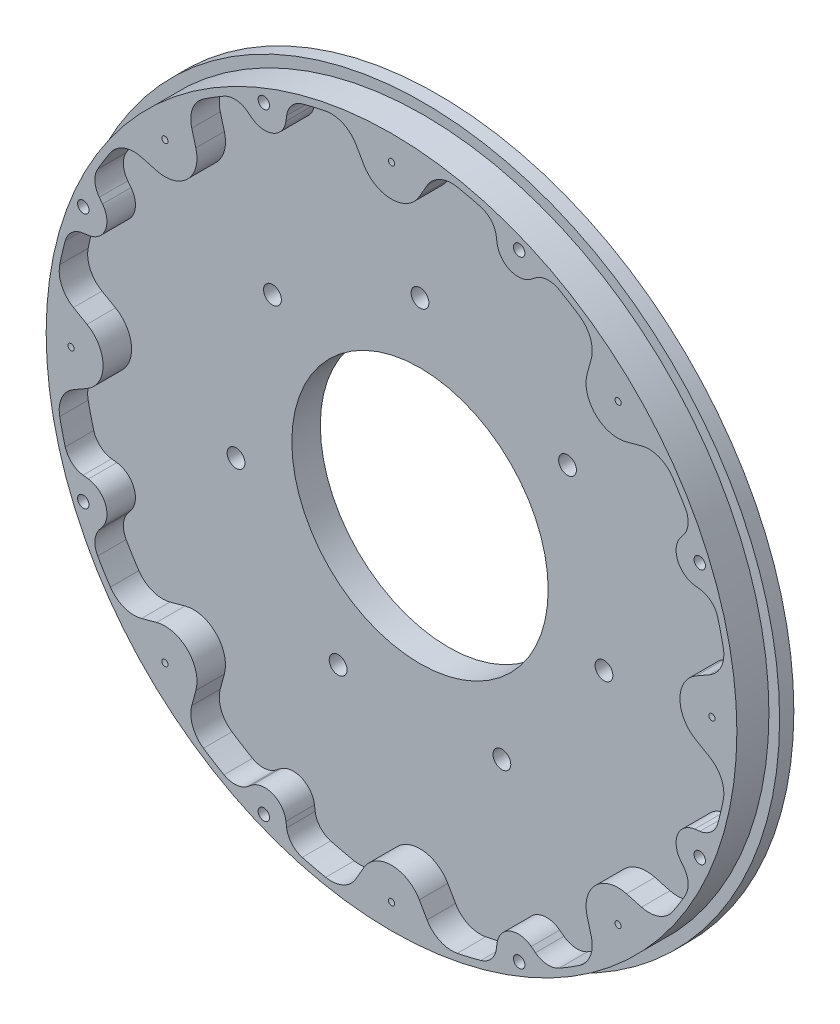
from build123d import *
from build123d.topology import SkipClean

# Parameters (mm, degrees)
SKETCH2_R             = 50
BOSS_EXTRUDE1_DEPTH   = 8
SKETCH3_R             = 18
CUT_EXTRUDE1_DEPTH    = 72.161787499
SKETCH5_R             = 50
SKETCH5_R_2           = 30
CUT_EXTRUDE2_DEPTH    = 1.5
CUT_EXTRUDE3_START    = 1.5
CUT_EXTRUDE3_DEPTH    = 1.5
CUT_EXTRUDE10_START   = 4
SKETCH18_R            = 31
SKETCH18_R_2          = 18
CUT_EXTRUDE10_DEPTH   = 4
CUT_EXTRUDE9_START    = 4
SKETCH7_R             = 31
CUT_EXTRUDE9_DEPTH    = 4
CUT_EXTRUDE12_START   = 3.5
SKETCH1_R             = 50
SKETCH1_R_2           = 48.5
CUT_EXTRUDE12_DEPTH   = 4.5
M3_TAPPED_HOLE1_D     = 2.5
M2_TAPPED_HOLE1_D     = 1.6
M2_TAPPED_HOLE1_DEPTH = 5.5
M2_TAPPED_HOLE1_TIP   = 0.480688495
M5_TAPPED_HOLE1_D     = 4.2
M5_TAPPED_HOLE1_DEPTH = 5.5
M5_TAPPED_HOLE1_TIP   = 1.2618073


with BuildPart() as part:
    # Sketch2 → Boss-Extrude1 (new body)
    with BuildSketch(Plane.XY):
        Circle(SKETCH2_R)
    extrude(amount=BOSS_EXTRUDE1_DEPTH)

    # Sketch3 → Cut-Extrude1 (cut, through all)
    with BuildSketch(Plane.XY):
        Circle(SKETCH3_R)
    extrude(amount=CUT_EXTRUDE1_DEPTH, mode=Mode.SUBTRACT)

    # Sketch5 → Cut-Extrude2 (cut)
    with BuildSketch(Plane.XY):
        Circle(SKETCH5_R)
        Circle(SKETCH5_R_2, mode=Mode.SUBTRACT)
    extrude(amount=CUT_EXTRUDE2_DEPTH, mode=Mode.SUBTRACT)

    # Sketch4 → Cut-Extrude3 (cut)
    with SkipClean():  # the faces are left unmerged after this step: merging them gives an invalid solid
        with BuildSketch(Plane.XY.offset(CUT_EXTRUDE3_START)):
            with BuildLine():
                Line((4, 41.412558482), (4, 32.249030993))
                ThreePointArc((4, 32.249030993), (4.664503168, 30.36609325), (6.363636364, 29.317300903))
                ThreePointArc((6.363636364, 29.317300903), (11.480502971, 27.716385975), (16.230691849, 25.2302327))
                ThreePointArc((16.230691849, 25.2302327), (18.173768634, 24.770372276), (19.975081377, 25.631935627))
                Line((19.975081377, 25.631935627), (26.454673804, 32.111528053))
                ThreePointArc((26.454673804, 32.111528053), (27.322845029, 34.483727178), (26.071450136, 36.678051854))
                ThreePointArc((26.071450136, 36.678051854), (17.220754456, 41.574578963), (7.5, 44.370598373))
                ThreePointArc((7.5, 44.370598373), (5.063508327, 43.703846329), (4, 41.412558482))
            make_face()
            with BuildLine():
                Line((32.111528053, 26.454673804), (25.631935627, 19.975081377))
                ThreePointArc((25.631935627, 19.975081377), (24.770372276, 18.173768634), (25.2302327, 16.230691849))
                ThreePointArc((25.2302327, 16.230691849), (27.716385975, 11.480502971), (29.317300903, 6.363636364))
                ThreePointArc((29.317300903, 6.363636364), (30.36609325, 4.664503168), (32.249030993, 4))
                Line((32.249030993, 4), (41.412558482, 4))
                ThreePointArc((41.412558482, 4), (43.703846329, 5.063508327), (44.370598373, 7.5))
                ThreePointArc((44.370598373, 7.5), (41.574578963, 17.220754456), (36.678051854, 26.071450136))
                ThreePointArc((36.678051854, 26.071450136), (34.483727178, 27.322845029), (32.111528053, 26.454673804))
            make_face()
            with BuildLine():
                Line((41.412558482, -4), (32.249030993, -4))
                ThreePointArc((32.249030993, -4), (30.36609325, -4.664503168), (29.317300903, -6.363636364))
                ThreePointArc((29.317300903, -6.363636364), (27.716385975, -11.480502971), (25.2302327, -16.230691849))
                ThreePointArc((25.2302327, -16.230691849), (24.770372276, -18.173768634), (25.631935627, -19.975081377))
                Line((25.631935627, -19.975081377), (32.111528053, -26.454673804))
                ThreePointArc((32.111528053, -26.454673804), (34.483727178, -27.322845029), (36.678051854, -26.071450136))
                ThreePointArc((36.678051854, -26.071450136), (41.574578963, -17.220754456), (44.370598373, -7.5))
                ThreePointArc((44.370598373, -7.5), (43.703846329, -5.063508327), (41.412558482, -4))
            make_face()
            with BuildLine():
                Line((26.454673804, -32.111528053), (19.975081377, -25.631935627))
                ThreePointArc((19.975081377, -25.631935627), (18.173768634, -24.770372276), (16.230691849, -25.2302327))
                ThreePointArc((16.230691849, -25.2302327), (11.480502971, -27.716385975), (6.363636364, -29.317300903))
                ThreePointArc((6.363636364, -29.317300903), (4.664503168, -30.36609325), (4, -32.249030993))
                Line((4, -32.249030993), (4, -41.412558482))
                ThreePointArc((4, -41.412558482), (5.063508327, -43.703846329), (7.5, -44.370598373))
                ThreePointArc((7.5, -44.370598373), (17.220754456, -41.574578963), (26.071450136, -36.678051854))
                ThreePointArc((26.071450136, -36.678051854), (27.322845029, -34.483727178), (26.454673804, -32.111528053))
            make_face()
            with BuildLine():
                Line((-4, -41.412558482), (-4, -32.249030993))
                ThreePointArc((-4, -32.249030993), (-4.664503168, -30.36609325), (-6.363636364, -29.317300903))
                ThreePointArc((-6.363636364, -29.317300903), (-11.480502971, -27.716385975), (-16.230691849, -25.2302327))
                ThreePointArc((-16.230691849, -25.2302327), (-18.173768634, -24.770372276), (-19.975081377, -25.631935627))
                Line((-19.975081377, -25.631935627), (-26.454673804, -32.111528053))
                ThreePointArc((-26.454673804, -32.111528053), (-27.322845029, -34.483727178), (-26.071450136, -36.678051854))
                ThreePointArc((-26.071450136, -36.678051854), (-17.220754456, -41.574578963), (-7.5, -44.370598373))
                ThreePointArc((-7.5, -44.370598373), (-5.063508327, -43.703846329), (-4, -41.412558482))
            make_face()
            with BuildLine():
                Line((-32.111528053, -26.454673804), (-25.631935627, -19.975081377))
                ThreePointArc((-25.631935627, -19.975081377), (-24.770372276, -18.173768634), (-25.2302327, -16.230691849))
                ThreePointArc((-25.2302327, -16.230691849), (-27.716385975, -11.480502971), (-29.317300903, -6.363636364))
                ThreePointArc((-29.317300903, -6.363636364), (-30.36609325, -4.664503168), (-32.249030993, -4))
                Line((-32.249030993, -4), (-41.412558482, -4))
                ThreePointArc((-41.412558482, -4), (-43.703846329, -5.063508327), (-44.370598373, -7.5))
                ThreePointArc((-44.370598373, -7.5), (-41.574578963, -17.220754456), (-36.678051854, -26.071450136))
                ThreePointArc((-36.678051854, -26.071450136), (-34.483727178, -27.322845029), (-32.111528053, -26.454673804))
            make_face()
            with BuildLine():
                Line((-41.412558482, 4), (-32.249030993, 4))
                ThreePointArc((-32.249030993, 4), (-30.36609325, 4.664503168), (-29.317300903, 6.363636364))
                ThreePointArc((-29.317300903, 6.363636364), (-27.716385975, 11.480502971), (-25.2302327, 16.230691849))
                ThreePointArc((-25.2302327, 16.230691849), (-24.770372276, 18.173768634), (-25.631935627, 19.975081377))
                Line((-25.631935627, 19.975081377), (-32.111528053, 26.454673804))
                ThreePointArc((-32.111528053, 26.454673804), (-34.483727178, 27.322845029), (-36.678051854, 26.071450136))
                ThreePointArc((-36.678051854, 26.071450136), (-41.574578963, 17.220754456), (-44.370598373, 7.5))
                ThreePointArc((-44.370598373, 7.5), (-43.703846329, 5.063508327), (-41.412558482, 4))
            make_face()
            with BuildLine():
                Line((-26.454673804, 32.111528053), (-19.975081377, 25.631935627))
                ThreePointArc((-19.975081377, 25.631935627), (-18.173768634, 24.770372276), (-16.230691849, 25.2302327))
                ThreePointArc((-16.230691849, 25.2302327), (-11.480502971, 27.716385975), (-6.363636364, 29.317300903))
                ThreePointArc((-6.363636364, 29.317300903), (-4.664503168, 30.36609325), (-4, 32.249030993))
                Line((-4, 32.249030993), (-4, 41.412558482))
                ThreePointArc((-4, 41.412558482), (-5.063508327, 43.703846329), (-7.5, 44.370598373))
                ThreePointArc((-7.5, 44.370598373), (-17.220754456, 41.574578963), (-26.071450136, 36.678051854))
                ThreePointArc((-26.071450136, 36.678051854), (-27.322845029, 34.483727178), (-26.454673804, 32.111528053))
            make_face()
        extrude(amount=CUT_EXTRUDE3_DEPTH, mode=Mode.SUBTRACT)

    # Sketch18 → Cut-Extrude10 (cut)
    with SkipClean():  # the faces are left unmerged after this step: merging them gives an invalid solid
        with BuildSketch(Plane.XY.offset(CUT_EXTRUDE10_START)):
            Circle(SKETCH18_R)
            Circle(SKETCH18_R_2, mode=Mode.SUBTRACT)
        extrude(amount=CUT_EXTRUDE10_DEPTH, mode=Mode.SUBTRACT)

    # Sketch7 → Cut-Extrude9 (cut)
    with SkipClean():  # the faces are left unmerged after this step: merging them gives an invalid solid
        with BuildSketch(Plane.XY.offset(CUT_EXTRUDE9_START)):
            with BuildLine():
                Line((-3.903770745, 42.761568859), (-4.991644615, 44.65879505))
                ThreePointArc((-4.991644615, 44.65879505), (-6.804376799, 46.309600732), (-9.239747013, 46.592671904))
                ThreePointArc((-9.239747013, 46.592671904), (-10.89690491, 46.233185737), (-12.540175609, 45.814779228))
                ThreePointArc((-12.540175609, 45.814779228), (-14.008988252, 44.893186851), (-14.722499102, 43.312792801))
                Line((-14.722499102, 43.312792801), (-14.820445021, 42.568819685))
                ThreePointArc((-14.820445021, 42.568819685), (-16.646729308, 40.188759664), (-19.621063892, 40.580338241))
                Line((-19.621063892, 40.580338241), (-20.21639055, 41.037148453))
                ThreePointArc((-20.21639055, 41.037148453), (-21.838426261, 41.650127442), (-23.52869786, 41.263184281))
                ThreePointArc((-23.52869786, 41.263184281), (-24.986523795, 40.397074506), (-26.412506487, 39.479482026))
                ThreePointArc((-26.412506487, 39.479482026), (-27.934411736, 37.557253688), (-28.048911063, 35.108162576))
                Line((-28.048911063, 35.108162576), (-27.476612549, 32.99737808))
                ThreePointArc((-27.476612549, 32.99737808), (-28.637824638, 28.637824638), (-32.99737808, 27.476612549))
                Line((-32.99737808, 27.476612549), (-35.108162576, 28.048911063))
                ThreePointArc((-35.108162576, 28.048911063), (-37.557253688, 27.934411736), (-39.479482026, 26.412506487))
                ThreePointArc((-39.479482026, 26.412506487), (-40.397074506, 24.986523795), (-41.263184281, 23.52869786))
                ThreePointArc((-41.263184281, 23.52869786), (-41.650127442, 21.838426261), (-41.037148453, 20.21639055))
                Line((-41.037148453, 20.21639055), (-40.580338241, 19.621063892))
                ThreePointArc((-40.580338241, 19.621063892), (-40.188759664, 16.646729308), (-42.568819685, 14.820445021))
                Line((-42.568819685, 14.820445021), (-43.312792801, 14.722499102))
                ThreePointArc((-43.312792801, 14.722499102), (-44.893186851, 14.008988252), (-45.814779228, 12.540175609))
                ThreePointArc((-45.814779228, 12.540175609), (-46.233185737, 10.89690491), (-46.592671904, 9.239747013))
                ThreePointArc((-46.592671904, 9.239747013), (-46.309600732, 6.804376799), (-44.65879505, 4.991644615))
                Line((-44.65879505, 4.991644615), (-42.761568859, 3.903770745))
                ThreePointArc((-42.761568859, 3.903770745), (-40.5, 0), (-42.761568859, -3.903770745))
                Line((-42.761568859, -3.903770745), (-44.65879505, -4.991644615))
                ThreePointArc((-44.65879505, -4.991644615), (-46.309600732, -6.804376799), (-46.592671904, -9.239747013))
                ThreePointArc((-46.592671904, -9.239747013), (-46.233185737, -10.89690491), (-45.814779228, -12.540175609))
                ThreePointArc((-45.814779228, -12.540175609), (-44.893186851, -14.008988252), (-43.312792801, -14.722499102))
                Line((-43.312792801, -14.722499102), (-42.568819685, -14.820445021))
                ThreePointArc((-42.568819685, -14.820445021), (-40.188759664, -16.646729308), (-40.580338241, -19.621063892))
                Line((-40.580338241, -19.621063892), (-41.037148453, -20.21639055))
                ThreePointArc((-41.037148453, -20.21639055), (-41.650127442, -21.838426261), (-41.263184281, -23.52869786))
                ThreePointArc((-41.263184281, -23.52869786), (-40.397074506, -24.986523795), (-39.479482026, -26.412506487))
                ThreePointArc((-39.479482026, -26.412506487), (-37.557253688, -27.934411736), (-35.108162576, -28.048911063))
                Line((-35.108162576, -28.048911063), (-32.99737808, -27.476612549))
                ThreePointArc((-32.99737808, -27.476612549), (-28.637824638, -28.637824638), (-27.476612549, -32.99737808))
                Line((-27.476612549, -32.99737808), (-28.048911063, -35.108162576))
                ThreePointArc((-28.048911063, -35.108162576), (-27.934411736, -37.557253688), (-26.412506487, -39.479482026))
                ThreePointArc((-26.412506487, -39.479482026), (-24.986523795, -40.397074506), (-23.52869786, -41.263184281))
                ThreePointArc((-23.52869786, -41.263184281), (-21.838426261, -41.650127442), (-20.21639055, -41.037148453))
                Line((-20.21639055, -41.037148453), (-19.621063892, -40.580338241))
                ThreePointArc((-19.621063892, -40.580338241), (-16.646729308, -40.188759664), (-14.820445021, -42.568819685))
                Line((-14.820445021, -42.568819685), (-14.722499102, -43.312792801))
                ThreePointArc((-14.722499102, -43.312792801), (-14.008988252, -44.893186851), (-12.540175609, -45.814779228))
                ThreePointArc((-12.540175609, -45.814779228), (-10.89690491, -46.233185737), (-9.239747013, -46.592671904))
                ThreePointArc((-9.239747013, -46.592671904), (-6.804376799, -46.309600732), (-4.991644615, -44.65879505))
                Line((-4.991644615, -44.65879505), (-3.903770745, -42.761568859))
                ThreePointArc((-3.903770745, -42.761568859), (0, -40.5), (3.903770745, -42.761568859))
                Line((3.903770745, -42.761568859), (4.991644615, -44.65879505))
                ThreePointArc((4.991644615, -44.65879505), (6.804376799, -46.309600732), (9.239747013, -46.592671904))
                ThreePointArc((9.239747013, -46.592671904), (10.89690491, -46.233185737), (12.540175609, -45.814779228))
                ThreePointArc((12.540175609, -45.814779228), (14.008988252, -44.893186851), (14.722499102, -43.312792801))
                Line((14.722499102, -43.312792801), (14.820445021, -42.568819685))
                ThreePointArc((14.820445021, -42.568819685), (16.646729308, -40.188759664), (19.621063892, -40.580338241))
                Line((19.621063892, -40.580338241), (20.21639055, -41.037148453))
                ThreePointArc((20.21639055, -41.037148453), (21.838426261, -41.650127442), (23.52869786, -41.263184281))
                ThreePointArc((23.52869786, -41.263184281), (24.986523795, -40.397074506), (26.412506487, -39.479482026))
                ThreePointArc((26.412506487, -39.479482026), (27.934411736, -37.557253688), (28.048911063, -35.108162576))
                Line((28.048911063, -35.108162576), (27.476612549, -32.99737808))
                ThreePointArc((27.476612549, -32.99737808), (28.637824638, -28.637824638), (32.99737808, -27.476612549))
                Line((32.99737808, -27.476612549), (35.108162576, -28.048911063))
                ThreePointArc((35.108162576, -28.048911063), (37.557253688, -27.934411736), (39.479482026, -26.412506487))
                ThreePointArc((39.479482026, -26.412506487), (40.397074506, -24.986523795), (41.263184281, -23.52869786))
                ThreePointArc((41.263184281, -23.52869786), (41.650127442, -21.838426261), (41.037148453, -20.21639055))
                Line((41.037148453, -20.21639055), (40.580338241, -19.621063892))
                ThreePointArc((40.580338241, -19.621063892), (40.188759664, -16.646729308), (42.568819685, -14.820445021))
                Line((42.568819685, -14.820445021), (43.312792801, -14.722499102))
                ThreePointArc((43.312792801, -14.722499102), (44.893186851, -14.008988252), (45.814779228, -12.540175609))
                ThreePointArc((45.814779228, -12.540175609), (46.233185737, -10.89690491), (46.592671904, -9.239747013))
                ThreePointArc((46.592671904, -9.239747013), (46.309600732, -6.804376799), (44.65879505, -4.991644615))
                Line((44.65879505, -4.991644615), (42.761568859, -3.903770745))
                ThreePointArc((42.761568859, -3.903770745), (40.5, 0), (42.761568859, 3.903770745))
                Line((42.761568859, 3.903770745), (44.65879505, 4.991644615))
                ThreePointArc((44.65879505, 4.991644615), (46.309600732, 6.804376799), (46.592671904, 9.239747013))
                ThreePointArc((46.592671904, 9.239747013), (46.233185737, 10.89690491), (45.814779228, 12.540175609))
                ThreePointArc((45.814779228, 12.540175609), (44.893186851, 14.008988252), (43.312792801, 14.722499102))
                Line((43.312792801, 14.722499102), (42.568819685, 14.820445021))
                ThreePointArc((42.568819685, 14.820445021), (40.188759664, 16.646729308), (40.580338241, 19.621063892))
                Line((40.580338241, 19.621063892), (41.037148453, 20.21639055))
                ThreePointArc((41.037148453, 20.21639055), (41.650127442, 21.838426261), (41.263184281, 23.52869786))
                ThreePointArc((41.263184281, 23.52869786), (40.397074506, 24.986523795), (39.479482026, 26.412506487))
                ThreePointArc((39.479482026, 26.412506487), (37.557253688, 27.934411736), (35.108162576, 28.048911063))
                Line((35.108162576, 28.048911063), (32.99737808, 27.476612549))
                ThreePointArc((32.99737808, 27.476612549), (28.637824638, 28.637824638), (27.476612549, 32.99737808))
                Line((27.476612549, 32.99737808), (28.048911063, 35.108162576))
                ThreePointArc((28.048911063, 35.108162576), (27.934411736, 37.557253688), (26.412506487, 39.479482026))
                ThreePointArc((26.412506487, 39.479482026), (24.986523795, 40.397074506), (23.52869786, 41.263184281))
                ThreePointArc((23.52869786, 41.263184281), (21.838426261, 41.650127442), (20.21639055, 41.037148453))
                Line((20.21639055, 41.037148453), (19.621063892, 40.580338241))
                ThreePointArc((19.621063892, 40.580338241), (16.646729308, 40.188759664), (14.820445021, 42.568819685))
                Line((14.820445021, 42.568819685), (14.722499102, 43.312792801))
                ThreePointArc((14.722499102, 43.312792801), (14.008988252, 44.893186851), (12.540175609, 45.814779228))
                ThreePointArc((12.540175609, 45.814779228), (10.89690491, 46.233185737), (9.239747013, 46.592671904))
                ThreePointArc((9.239747013, 46.592671904), (6.804376799, 46.309600732), (4.991644615, 44.65879505))
                Line((4.991644615, 44.65879505), (3.903770745, 42.761568859))
                ThreePointArc((3.903770745, 42.761568859), (0, 40.5), (-3.903770745, 42.761568859))
            make_face()
            Circle(SKETCH7_R, mode=Mode.SUBTRACT)
        extrude(amount=CUT_EXTRUDE9_DEPTH, mode=Mode.SUBTRACT)

    # Sketch1 → Cut-Extrude12 (cut)
    with SkipClean():  # the faces are left unmerged after this step: merging them gives an invalid solid
        with BuildSketch(Plane.XY.offset(CUT_EXTRUDE12_START)):
            Circle(SKETCH1_R)
            Circle(SKETCH1_R_2, mode=Mode.SUBTRACT)
        extrude(amount=CUT_EXTRUDE12_DEPTH, mode=Mode.SUBTRACT)

    # M3 Tapped Hole1 (through all)
    with Locations(Plane.XY.offset(4)):
        with Locations((-20.718534285, 16.522479749), (0, 26.5), (20.718534285, 16.522479749), (25.835589673, -5.89680475), (11.497919087, -23.875674999), (-11.497919087, -23.875674999), (-25.835589673, -5.89680475)):
            Hole(M3_TAPPED_HOLE1_D / 2)

    # M2 Tapped Hole1
    with Locations(Plane.XY.offset(8)):
        with Locations((-17.928718806, 43.283756098), (-43.283756098, 17.928718806), (-43.283756098, -17.928718806), (-17.928718806, -43.283756098), (17.928718806, -43.283756098), (43.283756098, -17.928718806), (43.283756098, 17.928718806), (17.928718806, 43.283756098)):
            Hole(M2_TAPPED_HOLE1_D / 2, depth=M2_TAPPED_HOLE1_DEPTH)
            with Locations((0, 0, -(M2_TAPPED_HOLE1_DEPTH + M2_TAPPED_HOLE1_TIP / 2))):  # 118° drill point
                Cone(0, M2_TAPPED_HOLE1_D / 2, M2_TAPPED_HOLE1_TIP, mode=Mode.SUBTRACT)

    # M5 Tapped Hole1
    with Locations(Plane(origin=(0, 0, 1.5), x_dir=(-1, 0, 0), z_dir=(0, 0, -1))):
        with Locations((0, 45), (-31.819805153, 31.819805153), (-45, 0), (-31.819805153, -31.819805153), (0, -45), (31.819805153, -31.819805153), (45, 0), (31.819805153, 31.819805153)):
            Hole(M5_TAPPED_HOLE1_D / 2, depth=M5_TAPPED_HOLE1_DEPTH)
            with Locations((0, 0, -(M5_TAPPED_HOLE1_DEPTH + M5_TAPPED_HOLE1_TIP / 2))):  # 118° drill point
                Cone(0, M5_TAPPED_HOLE1_D / 2, M5_TAPPED_HOLE1_TIP, mode=Mode.SUBTRACT)


solid = part.part
